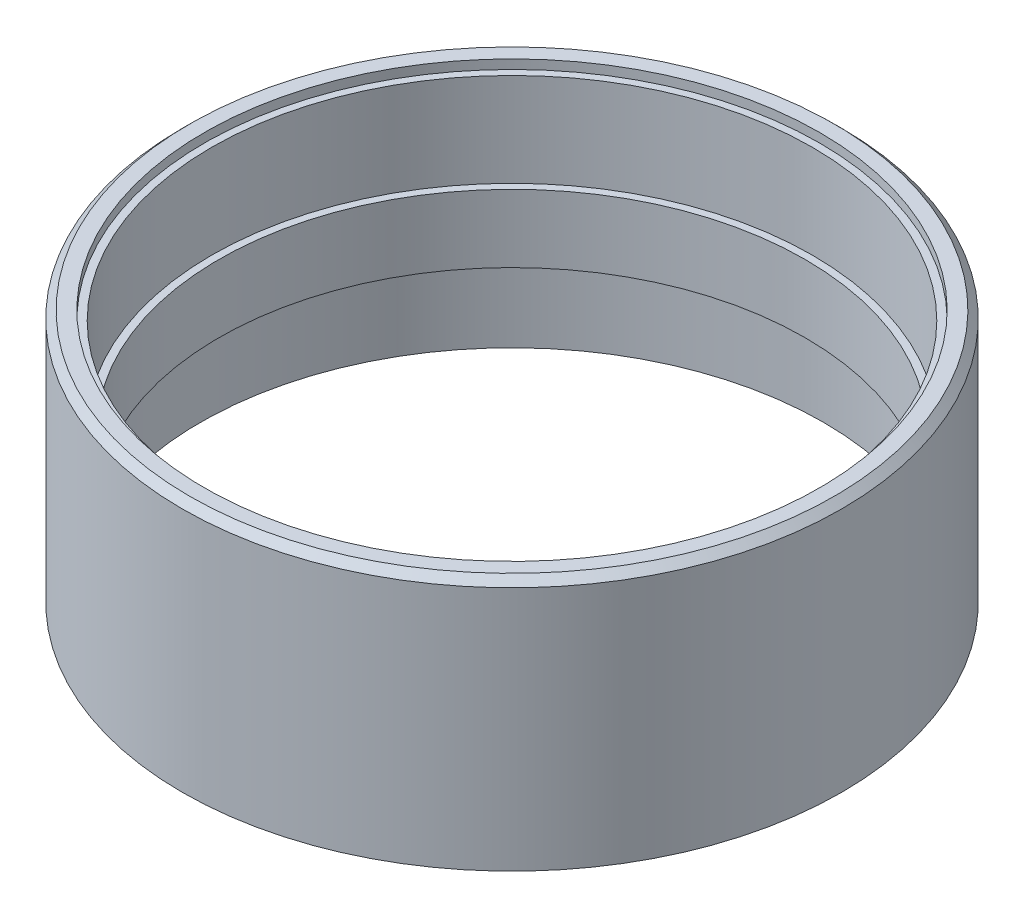
from build123d import *

# Parameters (mm, degrees)
CHAMFER1_SIZE       = 0.508
CHAMFER2_SIZE       = 0.254
BOSS_EXTRUDE1_REACH = 38.774
SKETCH2_R           = 22.86
SKETCH2_R_2         = 21.59


with BuildPart() as part:
    # Sketch1 → Revolve1 (revolve)
    with BuildSketch(Plane.XY, mode=Mode.PRIVATE) as revolve1_sk:
        Polygon((21.336, 16.891), (21.336, 17.526), (22.86, 17.526), (22.86, 0), (22.225, 0), (22.225, 2.413), (21.59, 2.413), (21.59, 5.588), (21.59, 5.715), (20.32, 5.715), (20.32, 10.414), (20.828, 10.414), (20.828, 16.256), (20.828, 16.891), align=None)
    revolve(revolve1_sk.sketch.rotate(Axis((0, -7.741318897, 0), (0, 1, 0)), 90), axis=Axis((0, -7.741318897, 0), (0, 1, 0)))

    # Chamfer1
    chamfer1_edges = [part.edges().sort_by_distance(p)[0] for p in [
        (0, 17.526, 22.86),
    ]]
    chamfer(chamfer1_edges, length=CHAMFER1_SIZE)

    # Chamfer2
    chamfer2_edges = [part.edges().sort_by_distance(p)[0] for p in [
        (0, 0, 22.225),
    ]]
    chamfer(chamfer2_edges, length=CHAMFER2_SIZE)

    # Sketch2 → Boss-Extrude1 (add, up to next)
    with BuildSketch(Plane.XZ, mode=Mode.PRIVATE) as boss_extrude1_sk1:
        with Locations(Location((0, 0, 0), (0, 0, 270))):
            Circle(SKETCH2_R)
        with Locations(Location((0, 0, 0), (0, 0, 270))):
            Circle(SKETCH2_R_2, mode=Mode.SUBTRACT)
    boss_extrude1_tool1 = extrude(boss_extrude1_sk1.sketch, amount=-BOSS_EXTRUDE1_REACH, mode=Mode.PRIVATE) - part.part
    add(boss_extrude1_tool1.solids().sort_by_distance((0, 0, 22.213422))[0])


solid = part.part
